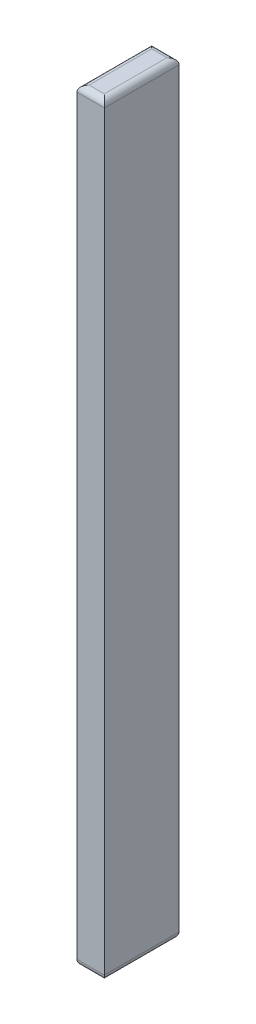
from build123d import *

# Parameters (mm, degrees)
SKETCH1_W           = 9
SKETCH1_H           = 24.5
BOSS_EXTRUDE1_DEPTH = 250
FILLET1_R           = 2


with BuildPart() as part:
    # Sketch1 → Boss-Extrude1 (new body)
    with BuildSketch(Plane(origin=(0, 0, 0), x_dir=(1, 0, 0), z_dir=(0, 1, 0))):
        with Locations((4.5, 12.25)):
            Rectangle(SKETCH1_W, SKETCH1_H)
    extrude(amount=BOSS_EXTRUDE1_DEPTH)

    # Fillet1
    fillet1_edges = [part.edges().sort_by_distance(p)[0] for p in [
        (9, 250, -12.25),
        (4.5, 250, -24.5),
        (0, 250, -12.25),
        (4.5, 0, -24.5),
        (9, 0, -12.25),
        (4.5, 0, 0),
        (0, 0, -12.25),
        (4.5, 250, 0),
    ]]
    fillet(fillet1_edges, radius=FILLET1_R)


solid = part.part
